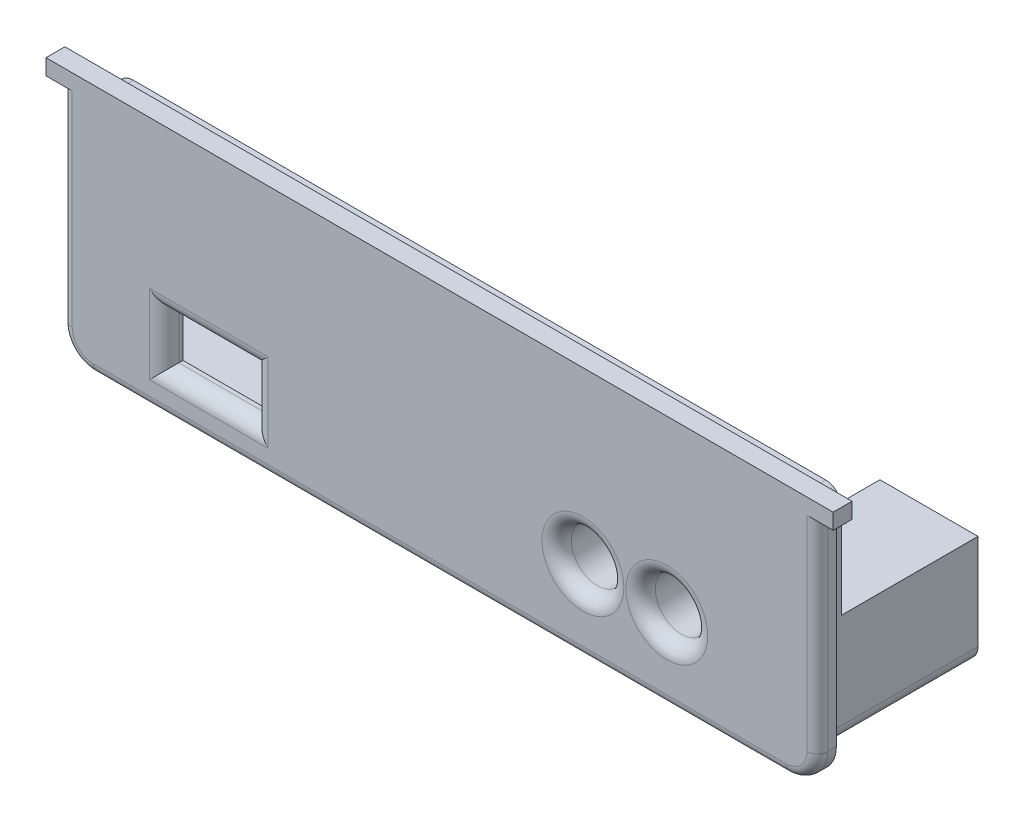
from build123d import *

# Parameters (mm, degrees)
BOSS_EXTRUDE1_DEPTH = 1.8
SKETCH2_W           = 69
SKETCH2_H           = 21
SKETCH2_W_2         = 65
SKETCH2_H_2         = 17
BOSS_EXTRUDE2_DEPTH = 15
SKETCH3_W           = 2
SKETCH3_H           = 14.5
CUT_EXTRUDE2_DEPTH  = 15
SKETCH4_W           = 69
SKETCH4_H           = 10.4
CUT_EXTRUDE4_DEPTH  = 13
BOSS_EXTRUDE4_DEPTH = 15
SKETCH8_W           = 16
SKETCH8_H           = 8.6
BOSS_EXTRUDE5_DEPTH = 10
SKETCH9_R           = 2.5
CUT_EXTRUDE5_DEPTH  = 12
CUT_EXTRUDE6_DEPTH  = 4
FILLET1_R           = 1.4
SKETCH11_W          = 8.5
SKETCH11_H          = 4.75
CUT_EXTRUDE7_DEPTH  = 4
FILLET2_R           = 1.4
FILLET6_R           = 1.5
FILLET7_R           = 1.5
FILLET8_R           = 3
FILLET9_R           = 1


with BuildPart() as part:
    # Sketch1 → Boss-Extrude1 (new body)
    with BuildSketch(Plane.XY):
        Polygon((0, 0), (72, 0), (72, 22.5), (73.5, 22.5), (73.5, 24), (72, 24), (0, 24), (-1.5, 24), (-1.5, 22.5), (0, 22.5), align=None)
    extrude(amount=BOSS_EXTRUDE1_DEPTH)

    # Sketch2 → Boss-Extrude2 (add)
    with BuildSketch(Plane(origin=(0, 0, 0), x_dir=(-1, 0, 0), z_dir=(0, 0, -1))):
        with Locations((-36, 12)):
            Rectangle(SKETCH2_W, SKETCH2_H)
        with Locations((-36, 12)):
            Rectangle(SKETCH2_W_2, SKETCH2_H_2, mode=Mode.SUBTRACT)
    extrude(amount=BOSS_EXTRUDE2_DEPTH)

    # Sketch3 → Cut-Extrude2 (cut)
    with BuildSketch(Plane(origin=(0, 0, -15), x_dir=(-1, 0, 0), z_dir=(0, 0, -1))):
        with Locations((-2.5, 13.25)):
            Rectangle(SKETCH3_W, SKETCH3_H)
    extrude(amount=-CUT_EXTRUDE2_DEPTH, mode=Mode.SUBTRACT)

    # Sketch4 → Cut-Extrude4 (cut)
    with BuildSketch(Plane(origin=(0, 0, -15), x_dir=(-1, 0, 0), z_dir=(0, 0, -1))):
        with Locations((-36, 17.3)):
            Rectangle(SKETCH4_W, SKETCH4_H)
    extrude(amount=-CUT_EXTRUDE4_DEPTH, mode=Mode.SUBTRACT)

    # Sketch7 → Boss-Extrude4 (add)
    with BuildSketch(Plane(origin=(0, 0, -15), x_dir=(-1, 0, 0), z_dir=(0, 0, -1))):
        Polygon((-68.5, 12.1), (-61.151923341, 12.1), (-61.151923341, 10.5), (-61.151923341, 3.5), (-62.751923341, 3.5), (-62.751923341, 10.5), (-68.5, 10.5), align=None)
    extrude(amount=-BOSS_EXTRUDE4_DEPTH)

    # Sketch8 → Boss-Extrude5 (add)
    with BuildSketch(Plane(origin=(0, 0, 0), x_dir=(-1, 0, 0), z_dir=(0, 0, -1))):
        with Locations((-53.151923341, 7.8)):
            Rectangle(SKETCH8_W, SKETCH8_H)
    extrude(amount=BOSS_EXTRUDE5_DEPTH)

    # Sketch9 → Cut-Extrude5 (cut)
    with BuildSketch(Plane(origin=(0, 0, -10), x_dir=(-1, 0, 0), z_dir=(0, 0, -1))):
        with Locations((-49.651923341, 7.8)):
            Circle(SKETCH9_R)
        with Locations((-57.651923341, 7.8)):
            Circle(SKETCH9_R)
    extrude(amount=-CUT_EXTRUDE5_DEPTH, mode=Mode.SUBTRACT)

    # Sketch10 → Cut-Extrude6 (cut)
    with BuildSketch(Plane(origin=(0, 0, -10), x_dir=(-1, 0, 0), z_dir=(0, 0, -1))):
        with BuildLine():
            Line((-57.651923341, 11.3), (-49.651923341, 11.3))
            ThreePointArc((-49.651923341, 11.3), (-46.151923341, 7.8), (-49.651923341, 4.3))
            Line((-49.651923341, 4.3), (-57.651923341, 4.3))
            ThreePointArc((-57.651923341, 4.3), (-61.151923341, 7.8), (-57.651923341, 11.3))
        make_face()
    extrude(amount=-CUT_EXTRUDE6_DEPTH, mode=Mode.SUBTRACT)

    # Fillet1
    fillet1_edges = [part.edges().sort_by_distance(p)[0] for p in [
        (52.151923341, 7.8, 1.8),
        (60.151923341, 7.8, 1.8),
    ]]
    fillet(fillet1_edges, radius=FILLET1_R)

    # Sketch11 → Cut-Extrude7 (cut)
    with BuildSketch(Plane.XY.offset(1.8)):
        with Locations((14, 6.125)):
            Rectangle(SKETCH11_W, SKETCH11_H)
    extrude(amount=-CUT_EXTRUDE7_DEPTH, mode=Mode.SUBTRACT)

    # Fillet2
    fillet2_edges = [part.edges().sort_by_distance(p)[0] for p in [
        (9.75, 6.125, 1.8),
        (14, 3.75, 1.8),
        (18.25, 6.125, 1.8),
        (14, 8.5, 1.8),
    ]]
    fillet(fillet2_edges, radius=FILLET2_R)

    # Fillet6
    fillet6_edges = [part.edges().sort_by_distance(p)[0] for p in [
        (70.5, 1.5, -7.5),
        (1.5, 1.5, -7.5),
    ]]
    fillet(fillet6_edges, radius=FILLET6_R)

    # Fillet7
    fillet7_edges = [part.edges().sort_by_distance(p)[0] for p in [
        (70.5, 22.5, -1),
        (1.5, 22.5, -1),
    ]]
    fillet(fillet7_edges, radius=FILLET7_R)

    # Fillet8
    fillet8_edges = [part.edges().sort_by_distance(p)[0] for p in [
        (72, 0, 0.9),
        (0, 0, 0.9),
    ]]
    fillet(fillet8_edges, radius=FILLET8_R)

    # Fillet9
    fillet9_edges = [part.edges().sort_by_distance(p)[0] for p in [
        (72, 12.75, 1.8),
        (36, 0, 1.8),
        (0.878679656, 0.878679656, 1.8),
        (71.121320344, 0.878679656, 1.8),
        (0, 12.75, 1.8),
    ]]
    fillet(fillet9_edges, radius=FILLET9_R)


solid = part.part
